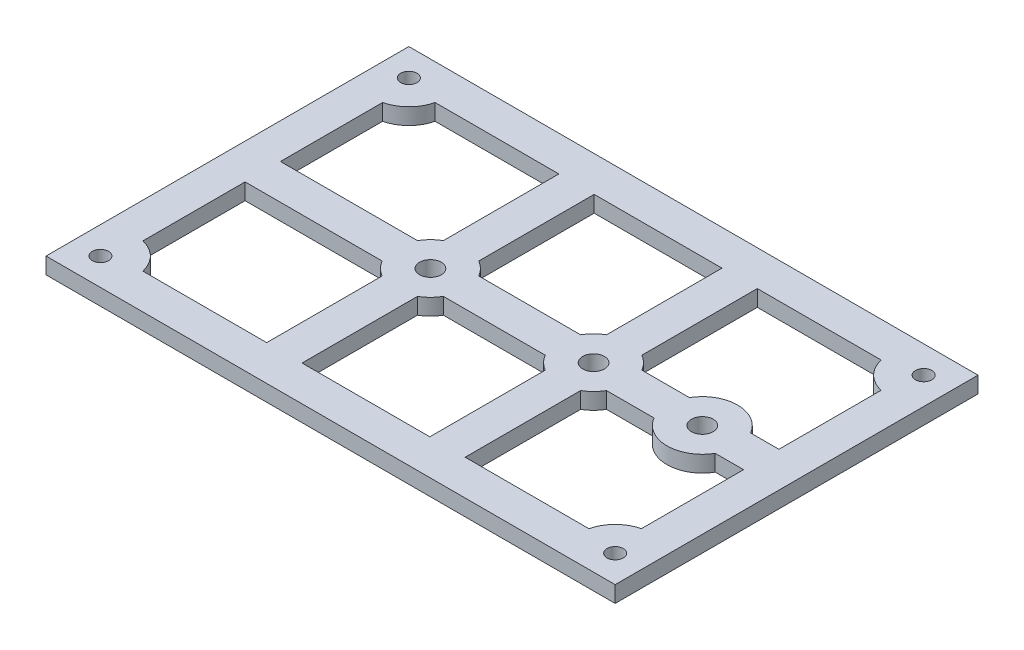
from build123d import *

# Parameters (mm, degrees)
SKETCH1_W           = 104.672897196
SKETCH1_H           = 66.728971962
SKETCH1_R           = 2
SKETCH1_R_2         = 1.5
BOSS_EXTRUDE1_DEPTH = 3


with BuildPart() as part:
    # Sketch1 → Boss-Extrude1 (new body)
    with BuildSketch(Plane(origin=(0, 0, 0), x_dir=(1, 0, 0), z_dir=(0, 1, 0))):
        Rectangle(SKETCH1_W, SKETCH1_H)
        with Locations(Location((35, 0, 0), (0, 0, 270))):
            Circle(SKETCH1_R, mode=Mode.SUBTRACT)
        with Locations(Location((15, 0, 0), (0, 0, 270))):
            Circle(SKETCH1_R, mode=Mode.SUBTRACT)
        with Locations(Location((-15, 0, 0), (0, 0, 270))):
            Circle(SKETCH1_R, mode=Mode.SUBTRACT)
        with Locations(Location((-47.336448598, 28.364485981, 0), (0, 0, 270))):
            Circle(SKETCH1_R_2, mode=Mode.SUBTRACT)
        with Locations(Location((47.336448598, 28.364485981, 0), (0, 0, 90))):
            Circle(SKETCH1_R_2, mode=Mode.SUBTRACT)
        with Locations(Location((-47.336448598, -28.364485981, 0), (0, 0, 90))):
            Circle(SKETCH1_R_2, mode=Mode.SUBTRACT)
        with Locations(Location((47.336448598, -28.364485981, 0), (0, 0, 270))):
            Circle(SKETCH1_R_2, mode=Mode.SUBTRACT)
        with BuildLine():
            Line((40.629165125, -3.25), (45.836448598, -3.25))
            Line((45.836448598, -3.25), (45.836448598, -22.039930661))
            ThreePointArc((45.836448598, -22.039930661), (42.74025452, -23.768291904), (41.011893278, -26.864485981))
            Line((41.011893278, -26.864485981), (18.25, -26.864485981))
            Line((18.25, -26.864485981), (18.25, -5.629165125))
            ThreePointArc((18.25, -5.629165125), (19.596194078, -4.596194078), (20.629165125, -3.25))
            Line((20.629165125, -3.25), (29.370834875, -3.25))
            ThreePointArc((29.370834875, -3.25), (35, -6.5), (40.629165125, -3.25))
        make_face(mode=Mode.SUBTRACT)
        with BuildLine():
            Line((-18.25, -26.864485981), (-18.25, -5.629165125))
            ThreePointArc((-18.25, -5.629165125), (-19.596194078, -4.596194078), (-20.629165125, -3.25))
            Line((-20.629165125, -3.25), (-45.836448598, -3.25))
            Line((-45.836448598, -3.25), (-45.836448598, -22.039930661))
            ThreePointArc((-45.836448598, -22.039930661), (-42.74025452, -23.768291904), (-41.011893278, -26.864485981))
            Line((-41.011893278, -26.864485981), (-18.25, -26.864485981))
        make_face(mode=Mode.SUBTRACT)
        with BuildLine():
            Line((-11.75, -26.864485981), (-11.75, -5.629165125))
            ThreePointArc((-11.75, -5.629165125), (-10.403805922, -4.596194078), (-9.370834875, -3.25))
            Line((-9.370834875, -3.25), (9.370834875, -3.25))
            ThreePointArc((9.370834875, -3.25), (10.403805922, -4.596194078), (11.75, -5.629165125))
            Line((11.75, -5.629165125), (11.75, -26.864485981))
            Line((11.75, -26.864485981), (-11.75, -26.864485981))
        make_face(mode=Mode.SUBTRACT)
        with BuildLine():
            Line((40.629165125, 3.25), (45.836448598, 3.25))
            Line((45.836448598, 3.25), (45.836448598, 22.039930661))
            ThreePointArc((45.836448598, 22.039930661), (42.74025452, 23.768291904), (41.011893278, 26.864485981))
            Line((41.011893278, 26.864485981), (18.25, 26.864485981))
            Line((18.25, 26.864485981), (18.25, 5.629165125))
            ThreePointArc((18.25, 5.629165125), (19.596194078, 4.596194078), (20.629165125, 3.25))
            Line((20.629165125, 3.25), (29.370834875, 3.25))
            ThreePointArc((29.370834875, 3.25), (35, 6.5), (40.629165125, 3.25))
        make_face(mode=Mode.SUBTRACT)
        with BuildLine():
            Line((-11.75, 26.864485981), (11.75, 26.864485981))
            Line((11.75, 26.864485981), (11.75, 5.629165125))
            ThreePointArc((11.75, 5.629165125), (10.403805922, 4.596194078), (9.370834875, 3.25))
            Line((9.370834875, 3.25), (-9.370834875, 3.25))
            ThreePointArc((-9.370834875, 3.25), (-10.403805922, 4.596194078), (-11.75, 5.629165125))
            Line((-11.75, 5.629165125), (-11.75, 26.864485981))
        make_face(mode=Mode.SUBTRACT)
        with BuildLine():
            Line((-45.836448598, 3.25), (-20.629165125, 3.25))
            ThreePointArc((-20.629165125, 3.25), (-19.596194078, 4.596194078), (-18.25, 5.629165125))
            Line((-18.25, 5.629165125), (-18.25, 26.864485981))
            Line((-18.25, 26.864485981), (-41.011893278, 26.864485981))
            ThreePointArc((-41.011893278, 26.864485981), (-42.74025452, 23.768291904), (-45.836448598, 22.039930661))
            Line((-45.836448598, 22.039930661), (-45.836448598, 6.771875217))
            Line((-45.836448598, 6.771875217), (-45.836448598, 3.25))
        make_face(mode=Mode.SUBTRACT)
    extrude(amount=BOSS_EXTRUDE1_DEPTH)


solid = part.part
